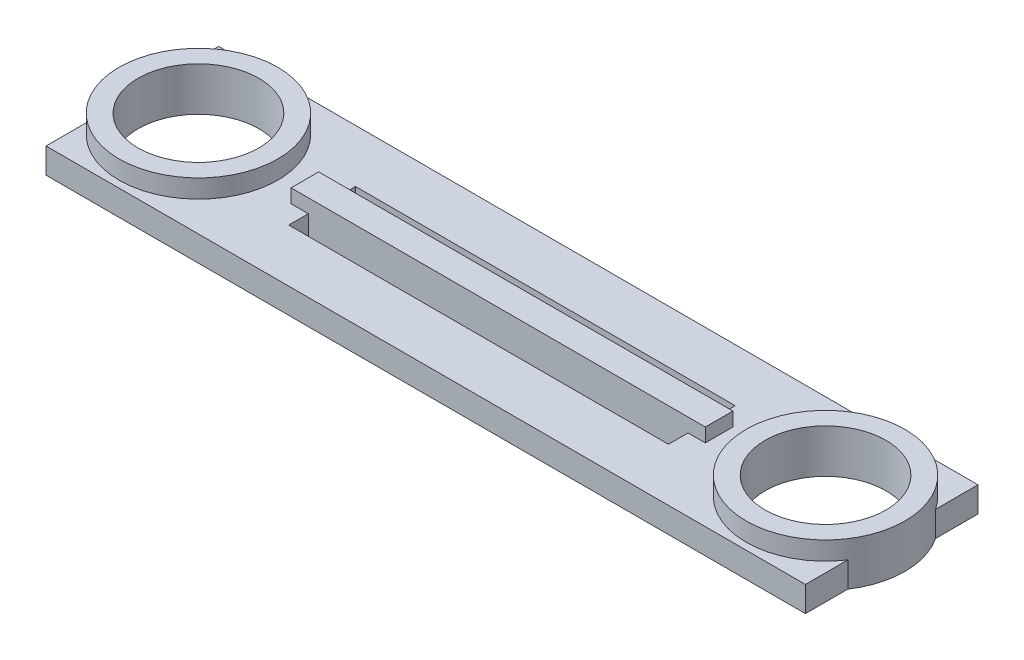
from build123d import *

# Parameters (mm, degrees)
F_01_LINK_PROFILE_W            = 660
F_01_LINK_PROFILE_H            = 150
F_01_LINK_PROFILE_R            = 52.5
F_01_LINK_PROFILE_W_2          = 330
F_01_LINK_PROFILE_H_2          = 58
F_01_LINK_PLATE_DEPTH          = 22
F_02_END_BOSS_PROFILES_R       = 69
F_02_END_BOSS_PROFILES_R_2     = 52.5
F_02_BEARING_SEAT_BOSSES_DEPTH = 38
F_03_CENTER_RIB_PROFILE_W      = 360
F_03_CENTER_RIB_PROFILE_H      = 24
F_03_CENTER_RIB_DEPTH          = 34


with BuildPart() as part:
    # 01_Link_Profile → 01_Link_Plate (new body)
    with BuildSketch(Plane(origin=(0, 0, 0), x_dir=(1, 0, 0), z_dir=(0, 1, 0))):
        Rectangle(F_01_LINK_PROFILE_W, F_01_LINK_PROFILE_H)
        with Locations(Location((-272.5, 0, 0), (0, 0, 270))):
            Circle(F_01_LINK_PROFILE_R, mode=Mode.SUBTRACT)
        with Locations(Location((272.5, 0, 0), (0, 0, 270))):
            Circle(F_01_LINK_PROFILE_R, mode=Mode.SUBTRACT)
        Rectangle(F_01_LINK_PROFILE_W_2, F_01_LINK_PROFILE_H_2, mode=Mode.SUBTRACT)
    extrude(amount=F_01_LINK_PLATE_DEPTH)

    # 02_End_Boss_Profiles → 02_Bearing_Seat_Bosses (add)
    # profile 1 of 2: a face of its own
    with BuildSketch(Plane(origin=(0, 0, 0), x_dir=(1, 0, 0), z_dir=(0, 1, 0))):
        with Locations(Location((-272.5, 0, 0), (0, 0, 146.442690238))):
            Circle(F_02_END_BOSS_PROFILES_R)
        with Locations(Location((-272.5, 0, 0), (0, 0, 270))):
            Circle(F_02_END_BOSS_PROFILES_R_2, mode=Mode.SUBTRACT)
    # profile 2 of 2: a face of its own
    with BuildSketch(Plane(origin=(0, 0, 0), x_dir=(1, 0, 0), z_dir=(0, 1, 0))):
        with Locations(Location((272.5, 0, 0), (0, 0, 33.557309762))):
            Circle(F_02_END_BOSS_PROFILES_R)
        with Locations(Location((272.5, 0, 0), (0, 0, 270))):
            Circle(F_02_END_BOSS_PROFILES_R_2, mode=Mode.SUBTRACT)
    extrude(amount=F_02_BEARING_SEAT_BOSSES_DEPTH)

    # 03_Center_Rib_Profile → 03_Center_Rib (add)
    with BuildSketch(Plane(origin=(0, 0, 0), x_dir=(1, 0, 0), z_dir=(0, 1, 0))):
        Rectangle(F_03_CENTER_RIB_PROFILE_W, F_03_CENTER_RIB_PROFILE_H)
    extrude(amount=F_03_CENTER_RIB_DEPTH)


solid = part.part
